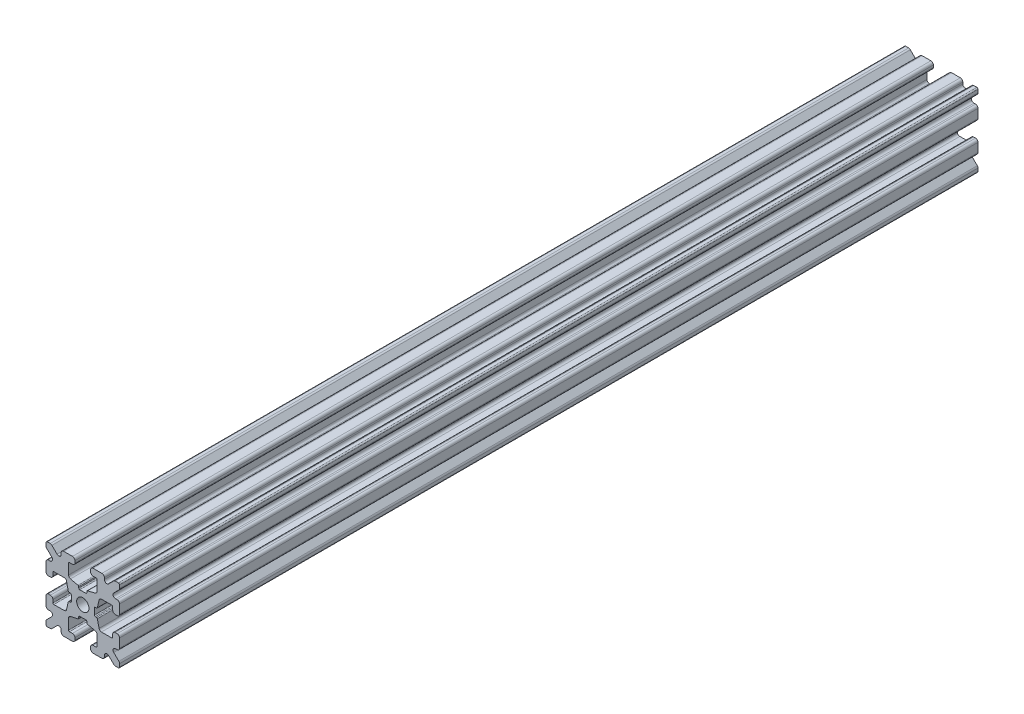
from build123d import *

# Parameters (mm, degrees)
SKETCH1_W           = 15
SKETCH1_H           = 15
SKETCH1_R           = 1.25
BOSS_EXTRUDE1_DEPTH = 87.5
FILLET1_R           = 0.25
CUT_EXTRUDE1_DEPTH  = 176.321133923
CUT_EXTRUDE3_DEPTH  = 176.321133923
FILLET3_R           = 0.5
FILLET4_R           = 0.5
FILLET5_R           = 3
FILLET6_R           = 0.2
CUT_EXTRUDE4_DEPTH  = 176.321133923
FILLET8_R           = 0.5
SKETCH6_W           = 5.1529354
SKETCH6_H           = 1.651
SKETCH6_W_2         = 1.651
SKETCH6_H_2         = 5.1529354
CUT_EXTRUDE5_DEPTH  = 176.321133923
FILLET10_R          = 0.2


with BuildPart() as part:
    # Sketch1 → Boss-Extrude1 (new, symmetric)
    with BuildSketch(Plane.XY):
        Rectangle(SKETCH1_W, SKETCH1_H)
        Circle(SKETCH1_R, mode=Mode.SUBTRACT)
    extrude(amount=BOSS_EXTRUDE1_DEPTH, both=True)

    # Fillet1
    fillet1_edges = [part.edges().sort_by_distance(p)[0] for p in [
        (7.5, -7.5, 0),
        (-7.5, -7.5, 0),
        (-7.5, 7.5, 0),
        (7.5, 7.5, 0),
    ]]
    fillet(fillet1_edges, radius=FILLET1_R)

    # Sketch2 → Cut-Extrude1 (cut, through all)
    with BuildSketch(Plane.XY.offset(87.5)):
        Polygon((-7.5, 1.6), (-6.1, 1.6), (-6.1, 2.9), (-3.4, 2.9), (-3.4, -2.9), (-6.1, -2.9), (-6.1, -1.6), (-7.5, -1.6), align=None)
        Polygon((2.9, 6.1), (1.6, 6.1), (1.6, 7.5), (-1.6, 7.5), (-1.6, 6.1), (-2.9, 6.1), (-2.9, 3.4), (2.9, 3.4), align=None)
        Polygon((-1.6, -7.5), (-1.6, -6.1), (-2.9, -6.1), (-2.9, -3.4), (2.9, -3.4), (2.9, -6.1), (1.6, -6.1), (1.6, -7.5), align=None)
        Polygon((6.1, -2.9), (6.1, -1.6), (7.5, -1.6), (7.5, 1.6), (6.1, 1.6), (6.1, 2.9), (3.4, 2.9), (3.4, -2.9), align=None)
    extrude(amount=-CUT_EXTRUDE1_DEPTH, mode=Mode.SUBTRACT)

    # Sketch4 → Cut-Extrude3 (cut, through all)
    with BuildSketch(Plane.XY.offset(87.5)):
        Polygon((-3.4, 2.9), (-2.75, 0), (-3.4, -2.9), align=None)
        Polygon((-2.9, 3.4), (0, 2.75), (2.9, 3.4), align=None)
        Polygon((3.4, 2.9), (2.75, 0), (3.4, -2.9), align=None)
        Polygon((-2.9, -3.4), (0, -2.75), (2.9, -3.4), align=None)
    extrude(amount=-CUT_EXTRUDE3_DEPTH, mode=Mode.SUBTRACT)

    # Fillet3
    fillet3_edges = [part.edges().sort_by_distance(p)[0] for p in [
        (1.6, -7.5, 0),
        (-1.6, -7.5, 0),
        (-1.6, -6.1, 0),
        (1.6, -6.1, 0),
        (6.1, 1.6, 0),
        (7.5, 1.6, 0),
        (7.5, -1.6, 0),
        (6.1, -1.6, 0),
        (-7.5, -1.6, 0),
        (-7.5, 1.6, 0),
        (-6.1, 1.6, 0),
        (-6.1, -1.6, 0),
        (-1.6, 6.1, 0),
        (-1.6, 7.5, 0),
        (1.6, 7.5, 0),
        (1.6, 6.1, 0),
    ]]
    fillet(fillet3_edges, radius=FILLET3_R)

    # Fillet4
    fillet4_edges = [part.edges().sort_by_distance(p)[0] for p in [
        (-2.9, -3.4, 0),
        (2.9, -3.4, 0),
        (3.4, -2.9, 0),
        (3.4, 2.9, 0),
        (-3.4, 2.9, 0),
        (-3.4, -2.9, 0),
        (2.9, 3.4, 0),
        (-2.9, 3.4, 0),
    ]]
    fillet(fillet4_edges, radius=FILLET4_R)

    # Fillet5
    fillet5_edges = [part.edges().sort_by_distance(p)[0] for p in [
        (-2.75, 0, 0),
        (0, 2.75, 0),
        (2.75, 0, 0),
        (0, -2.75, 0),
    ]]
    fillet(fillet5_edges, radius=FILLET5_R)

    # Fillet6
    fillet6_edges = [part.edges().sort_by_distance(p)[0] for p in [
        (-2.9, -6.1, 0),
        (2.9, -6.1, 0),
        (6.1, -2.9, 0),
        (6.1, 2.9, 0),
        (-6.1, 2.9, 0),
        (-6.1, -2.9, 0),
        (2.9, 6.1, 0),
        (-2.9, 6.1, 0),
    ]]
    fillet(fillet6_edges, radius=FILLET6_R)

    # Sketch5 → Cut-Extrude4 (cut, through all)
    with BuildSketch(Plane.XY.offset(87.5)):
        Polygon((-7.5, 6.439339828), (-5.460660172, 4.4), (-7.5, 4.4), align=None)
        Polygon((-6.439339828, 7.5), (-4.4, 5.460660172), (-4.4, 7.5), align=None)
        Polygon((4.4, 7.5), (6.439339828, 7.5), (4.4, 5.460660172), align=None)
        Polygon((7.5, 6.439339828), (7.5, 4.4), (5.460660172, 4.4), align=None)
        Polygon((7.5, -6.439339828), (5.460660172, -4.4), (7.5, -4.4), align=None)
        Polygon((6.439339828, -7.5), (4.4, -5.460660172), (4.4, -7.5), align=None)
        Polygon((-4.4, -7.5), (-6.439339828, -7.5), (-4.4, -5.460660172), align=None)
        Polygon((-7.5, -6.439339828), (-7.5, -4.4), (-5.460660172, -4.4), align=None)
    extrude(amount=-CUT_EXTRUDE4_DEPTH, mode=Mode.SUBTRACT)

    # Fillet8
    fillet8_edges = [part.edges().sort_by_distance(p)[0] for p in [
        (-7.5, 4.4, 0),
        (-7.5, 6.439339828, 0),
        (-5.460660172, 4.4, 0),
        (7.5, -4.4, 0),
        (7.5, -6.439339828, 0),
        (5.460660172, -4.4, 0),
        (5.460660172, 4.4, 0),
        (7.5, 6.439339828, 0),
        (7.5, 4.4, 0),
        (-4.4, 7.5, 0),
        (-4.4, 5.460660172, 0),
        (-6.439339828, 7.5, 0),
        (-5.460660172, -4.4, 0),
        (-7.5, -6.439339828, 0),
        (-7.5, -4.4, 0),
        (4.4, 5.460660172, 0),
        (4.4, 7.5, 0),
        (6.439339828, 7.5, 0),
        (6.439339828, -7.5, 0),
        (4.4, -7.5, 0),
        (4.4, -5.460660172, 0),
        (-6.439339828, -7.5, 0),
        (-4.4, -5.460660172, 0),
        (-4.4, -7.5, 0),
    ]]
    fillet(fillet8_edges, radius=FILLET8_R)

    # Sketch6 → Cut-Extrude5 (cut, through all)
    with BuildSketch(Plane.XY.offset(87.5)):
        with Locations((4.9235323, 0)):
            Rectangle(SKETCH6_W, SKETCH6_H)
        with Locations((0, -4.9235323)):
            Rectangle(SKETCH6_W_2, SKETCH6_H_2)
        with Locations((-4.9235323, 0)):
            Rectangle(SKETCH6_W, SKETCH6_H)
        with Locations((0, 4.9235323)):
            Rectangle(SKETCH6_W_2, SKETCH6_H_2)
    extrude(amount=-CUT_EXTRUDE5_DEPTH, mode=Mode.SUBTRACT)

    # Fillet10
    fillet10_edges = [part.edges().sort_by_distance(p)[0] for p in [
        (0.8255, -2.935025862, 0),
        (-0.8255, -2.935025862, 0),
        (0.8255, -2.3470646, 0),
        (-0.8255, -2.3470646, 0),
        (2.935025862, 0.8255, 0),
        (2.935025862, -0.8255, 0),
        (2.3470646, 0.8255, 0),
        (2.3470646, -0.8255, 0),
        (-2.935025862, -0.8255, 0),
        (-2.935025862, 0.8255, 0),
        (-2.3470646, -0.8255, 0),
        (-2.3470646, 0.8255, 0),
        (-0.8255, 2.935025862, 0),
        (0.8255, 2.935025862, 0),
        (-0.8255, 2.3470646, 0),
        (0.8255, 2.3470646, 0),
    ]]
    fillet(fillet10_edges, radius=FILLET10_R)


solid = part.part
